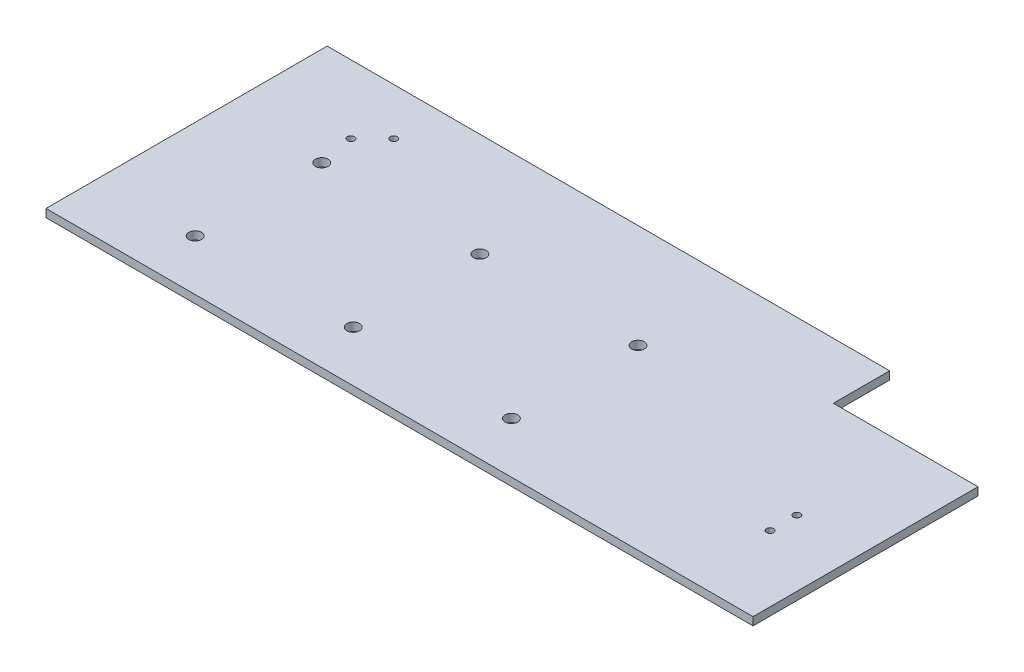
from build123d import *

# Parameters (mm, degrees)
BOSS_EXTRUDE1_DEPTH     = 6.35
CUT_EXTRUDE3_DEPTH      = 602.409033022
CUT_EXTRUDE3_DEPTH_BACK = 602.409033022
SKETCH10_R              = 5.0000027
SKETCH2_R               = 2.778125
CUT_EXTRUDE4_DEPTH      = 602.409033022


with BuildPart() as part:
    # Sketch1 → Boss-Extrude1 (new body)
    with BuildSketch(Plane(origin=(0, 0, 0), x_dir=(1, 0, 0), z_dir=(0, 1, 0))):
        Polygon((0, 0), (0, 177.8), (-114.3, 177.8), (-114.3, 222.25), (-558.8, 222.25), (-558.8, 0), align=None)
    extrude(amount=BOSS_EXTRUDE1_DEPTH)

    # Sketch10 → Cut-Extrude3 (cut, two sides: drawn at the far end of the back side and taken through both)
    with BuildSketch(Plane(origin=(0, 6.35, 0), x_dir=(1, 0, 0), z_dir=(0, 1, 0)).offset(-CUT_EXTRUDE3_DEPTH_BACK)):
        with Locations(Location((-481.076, 40.132, 0), (0, 0, 270))):
            Circle(SKETCH10_R)
        with Locations(Location((-356.108, 40.132, 0), (0, 0, 270))):
            Circle(SKETCH10_R)
        with Locations(Location((-231.14, 40.132, 0), (0, 0, 270))):
            Circle(SKETCH10_R)
        with Locations(Location((-356.108, 140.208, 0), (0, 0, 270))):
            Circle(SKETCH10_R)
        with Locations(Location((-231.14, 140.208, 0), (0, 0, 270))):
            Circle(SKETCH10_R)
        with Locations(Location((-481.076, 140.208, 0), (0, 0, 270))):
            Circle(SKETCH10_R)
    extrude(amount=CUT_EXTRUDE3_DEPTH + CUT_EXTRUDE3_DEPTH_BACK, mode=Mode.SUBTRACT)

    # Sketch2 → Cut-Extrude4 (cut, through all)
    with BuildSketch(Plane.XZ):
        with Locations(Location((-52.1589, -86.783333333, 0), (0, 0, 270))):
            Circle(SKETCH2_R)
        with Locations(Location((-52.1589, -65.616666667, 0), (0, 0, 270))):
            Circle(SKETCH2_R)
        with Locations(Location((-469.142233333, -185.187166667, 0), (0, 0, 270))):
            Circle(SKETCH2_R)
        with Locations(Location((-486.075566667, -168.253833333, 0), (0, 0, 270))):
            Circle(SKETCH2_R)
    extrude(amount=-CUT_EXTRUDE4_DEPTH, mode=Mode.SUBTRACT)


solid = part.part
